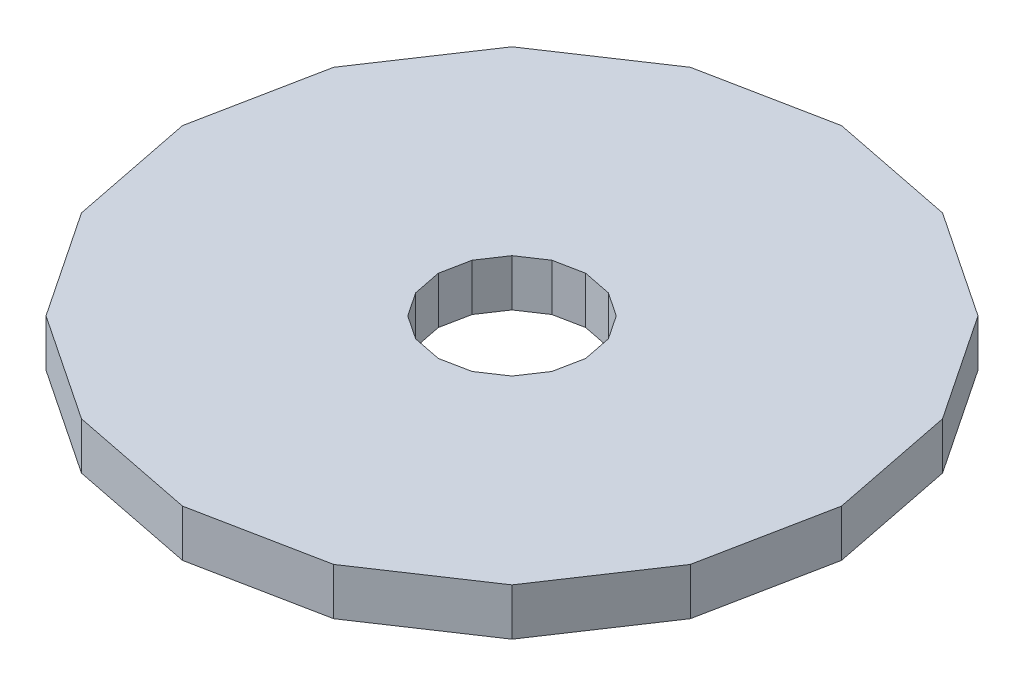
from build123d import *

# Parameters (mm, degrees)
BOSS_EXTRUDE1_DEPTH = 19.05


with BuildPart() as part:
    # Sketch1 → Boss-Extrude1 (new body)
    with BuildSketch(Plane(origin=(0, 0, 0), x_dir=(1, 0, 0), z_dir=(0, 1, 0))):
        Polygon((133.451007364, 0), (123.292654297, 51.069489551), (94.364112263, 94.364112263), (51.069489551, 123.292654297), (0, 133.451007364), (-51.069489551, 123.292654297), (-94.364112263, 94.364112263), (-123.292654297, 51.069489551), (-133.451007364, 0), (-123.292654297, -51.069489551), (-94.364112263, -94.364112263), (-51.069489551, -123.292654297), (0, -133.451007364), (51.069489551, -123.292654297), (94.364112263, -94.364112263), (123.292654297, -51.069489551), align=None)
        Polygon((29.86054569, 0), (27.587546993, 11.427136117), (21.114594347, 21.114594347), (11.427136117, 27.587546993), (0, 29.86054569), (-11.427136117, 27.587546993), (-21.114594347, 21.114594347), (-27.587546993, 11.427136117), (-29.86054569, 0), (-27.587546993, -11.427136117), (-21.114594347, -21.114594347), (-11.427136117, -27.587546993), (0, -29.86054569), (11.427136117, -27.587546993), (21.114594347, -21.114594347), (27.587546993, -11.427136117), align=None, mode=Mode.SUBTRACT)
    extrude(amount=BOSS_EXTRUDE1_DEPTH)


solid = part.part
